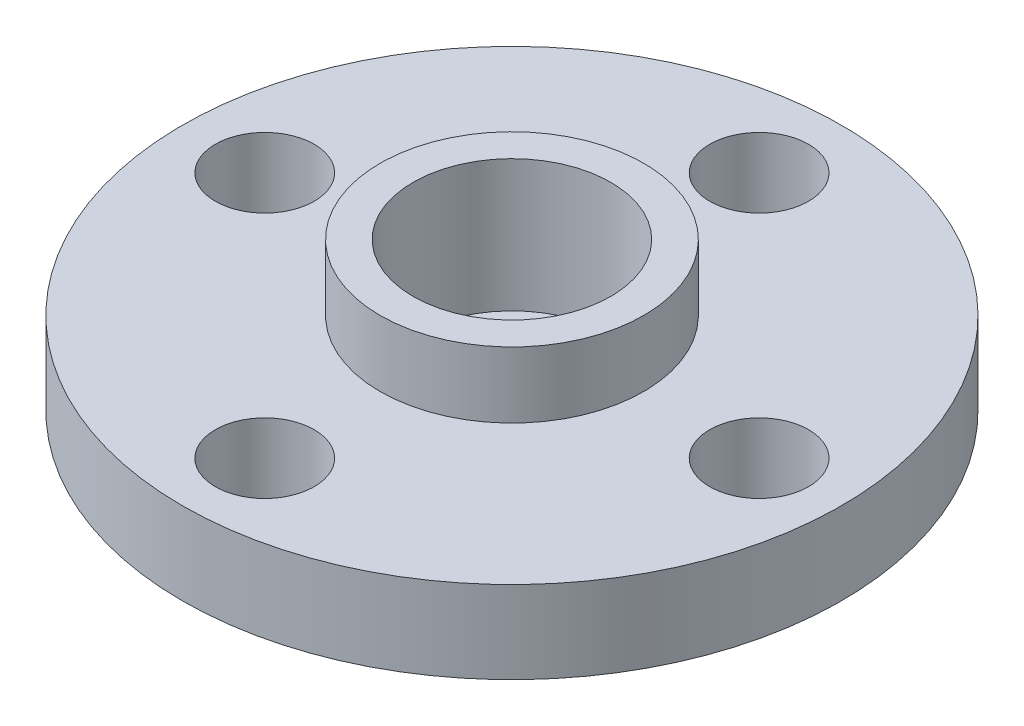
from build123d import *

# Parameters (mm, degrees)
SKETCH2_R          = 1.5
CUT_EXTRUDE1_DEPTH = 10


with BuildPart() as part:
    # Sketch1 → Revolve1 (revolve)
    with BuildSketch(Plane.XY, mode=Mode.PRIVATE) as revolve1_sk:
        Polygon((3, 0), (4, 0), (4, -2), (10, -2), (10, -4.5), (1.5, -4.5), (1.5, -4), (3, -4), align=None)
    revolve(revolve1_sk.sketch.rotate(Axis((0, 3.424478083, 0), (0, -1, 0)), 90), axis=Axis((0, 3.424478083, 0), (0, -1, 0)))

    # Sketch2 → Cut-Extrude1 (cut)
    with BuildSketch(Plane.XZ.offset(4.5)):
        with Locations(Location((0, -7.5, 0), (0, 0, 270))):
            Circle(SKETCH2_R)
        with Locations(Location((-7.5, 0, 0), (0, 0, 270))):
            Circle(SKETCH2_R)
        with Locations(Location((0, 7.5, 0), (0, 0, 270))):
            Circle(SKETCH2_R)
        with Locations(Location((7.5, 0, 0), (0, 0, 270))):
            Circle(SKETCH2_R)
    extrude(amount=-CUT_EXTRUDE1_DEPTH, mode=Mode.SUBTRACT)


solid = part.part
